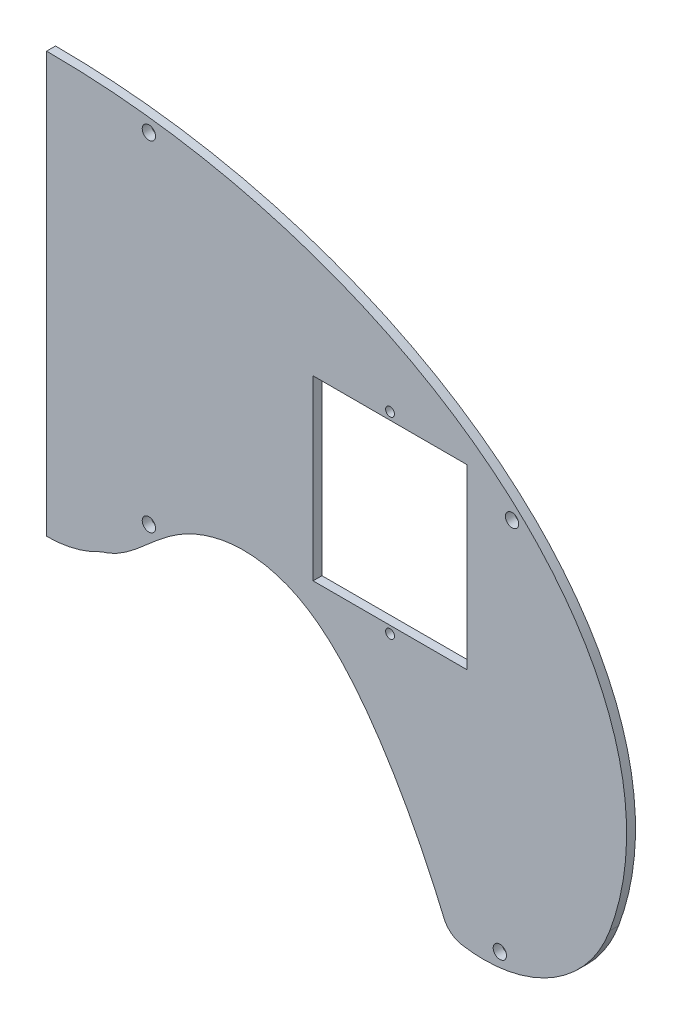
from build123d import *

# Parameters (mm, degrees)
CROQUIS7_R                 = 2.25
CROQUIS7_R_2               = 2
SALIENTE_EXTRUIR5_DEPTH    = 3
CROQUIS8_W                 = 14.2
CROQUIS8_H                 = 14.2
SALIENTE_EXTRUIR6_DEPTH    = 30
CROQUIS9_W                 = 12.2
CROQUIS9_H                 = 12.2
CORTAR_EXTRUIR3_DEPTH      = 3.5
CROQUIS10_R                = 1.5
CROQUIS10_W                = 52
CROQUIS10_H                = 60
CORTAR_EXTRUIR4_DEPTH      = 10
CROQUIS11_R                = 2
CORTAR_EXTRUIR5_DEPTH      = 244.062677057
CORTAR_EXTRUIR6_DEPTH      = 10
CORTAR_EXTRUIR6_DEPTH_BACK = 40


with BuildPart() as part:
    # Croquis7 → Saliente-Extruir5 (new body)
    with BuildSketch(Plane(origin=(0, 0, 0), x_dir=(-1, 0, 0), z_dir=(0, 0, 1))):
        with BuildLine():
            ThreePointArc((140.348102944, 60.535906772), (136.868803986, 59.039740818), (134.467588313, 56.110884882))
            add(Edge.make_bspline(
                [(134.467588313, 56.110884882), (134.149654238, 55.334133411), (133.822967437, 54.561974551), (133.162468089, 53.021395753), (132.827829682, 52.253409151), (131.813137405, 49.95510413), (129.740491118, 45.381193792), (127.554094799, 40.866968809), (124.537000873, 34.901469121), (122.977142227, 31.945642839), (119.740627649, 26.095274542), (118.063871011, 23.200785369), (115.441409795, 18.91536637), (114.549338579, 17.496294783), (112.72383113, 14.679856092), (111.790405163, 13.282650688), (108.93090019, 9.143306555), (106.942158815, 6.448783713), (103.789519774, 2.5408027), (102.709995436, 1.260750849), (101.03852657, -0.618140745), (100.472644941, -1.237551258), (99.321371183, -2.460973153), (98.735216612, -3.065706766), (96.949611744, -4.848397798), (95.725315546, -5.992490783), (93.193460811, -8.17168186), (91.885551874, -9.206321258), (89.163749912, -11.136861166), (87.750446472, -12.033533472), (85.542380661, -13.263200338), (84.789940556, -13.654501875), (83.273337808, -14.386945731), (82.507210908, -14.729300557), (80.185156663, -15.684162987), (78.605545886, -16.224438396), (76.18690973, -16.88473526), (75.372506069, -17.079850593), (73.726807841, -17.418565616), (72.893614615, -17.562445585), (68.705243638, -18.145869815), (65.366316414, -18.172349369), (61.206552273, -17.685687456), (60.375297364, -17.562248247), (58.714202725, -17.262432714), (57.885084071, -17.085992517), (55.432802766, -16.486020136), (53.833347943, -15.990242323), (50.701372835, -14.817551431), (49.168805031, -14.140766948), (46.919374597, -12.991848579), (46.176109393, -12.585433423), (44.71844096, -11.734682347), (44.00330992, -11.290078896), (41.89786804, -9.900210079), (40.548675898, -8.897248108), (37.915404815, -6.799959147), (36.631444442, -5.705240729), (34.080234787, -3.494531224), (32.813017874, -2.37801674), (30.236662295, -0.200762722), (28.927839074, 0.860396497), (26.200660035, 2.836986891), (24.782534521, 3.752724475), (22.513326989, 4.937380803), (21.731218891, 5.30092632), (20.538800155, 5.779648827), (20.137325925, 5.928599802), (19.528876591, 6.135464876), (19.325056364, 6.201754934), (18.915138447, 6.32828856), (18.709169476, 6.388873867), (18.503492991, 6.450235701)],
                knots=[0, 0, 0, 0, 0.015625, 0.015625, 0.03125, 0.03125, 0.0625, 0.125, 0.125, 0.1875, 0.1875, 0.25, 0.25, 0.28125, 0.28125, 0.3125, 0.3125, 0.375, 0.375, 0.40625, 0.40625, 0.421875, 0.421875, 0.4375, 0.4375, 0.46875, 0.46875, 0.5, 0.5, 0.53125, 0.53125, 0.546875, 0.546875, 0.5625, 0.5625, 0.59375, 0.59375, 0.609375, 0.609375, 0.625, 0.625, 0.6875, 0.6875, 0.703125, 0.703125, 0.71875, 0.71875, 0.75, 0.75, 0.78125, 0.78125, 0.796875, 0.796875, 0.8125, 0.8125, 0.84375, 0.84375, 0.875, 0.875, 0.90625, 0.90625, 0.9375, 0.9375, 0.96875, 0.96875, 0.984375, 0.984375, 0.9921875, 0.9921875, 0.99609375, 0.99609375, 1, 1, 1, 1], degree=3))
            ThreePointArc((18.503492991, 6.450235701), (9.568725558, 9.968187997), (0.041286445, 11.165669263))
            ThreePointArc((0.041286445, 11.165669263), (-9.486152668, 9.968187997), (-18.420920101, 6.450235701))
            add(Edge.make_bspline(
                [(-18.420920101, 6.450235701), (-18.623940111, 6.389666404), (-18.827355959, 6.329830822), (-19.231521602, 6.205217931), (-19.432092857, 6.140109685), (-20.029834347, 5.937422038), (-20.422847663, 5.792137477), (-21.586408936, 5.327592923), (-23.851571133, 4.283655696), (-25.957152112, 2.943922804), (-27.995784216, 1.480095188), (-28.664890842, 0.970984568), (-29.983921002, -0.073329511), (-31.932785293, -1.677966714), (-33.830609801, -3.348234863), (-37.648198778, -6.660559044), (-40.223642402, -8.829704647), (-43.732103414, -11.16931662), (-44.447751487, -11.619293464), (-45.90833942, -12.481581481), (-46.654055565, -12.894111913), (-48.910026429, -14.05945093), (-50.447191979, -14.745557377), (-53.587886072, -15.936216829), (-55.191605427, -16.440247818), (-57.65002542, -17.051733947), (-58.478840799, -17.231454942), (-60.152957814, -17.539864916), (-60.990189376, -17.667132679), (-65.177200996, -18.170568112), (-68.529524477, -18.150830669), (-72.723459823, -17.57652989), (-73.56537326, -17.433195972), (-75.227722525, -17.094199895), (-76.049649818, -16.898572429), (-78.48861692, -16.235921786), (-80.078810549, -15.693041625), (-82.413070582, -14.734529063), (-83.182665748, -14.391031128), (-84.704996506, -13.656396586), (-85.459349689, -13.264347284), (-87.686334065, -12.023619951), (-89.109100698, -11.119013238), (-91.845960574, -9.173794538), (-93.159325686, -8.13227129), (-95.699651961, -5.941089833), (-96.92657944, -4.791389468), (-99.311327975, -2.405501713), (-100.470747098, -1.167746926), (-102.705277757, 1.350255866), (-103.784333544, 2.63413345), (-106.931979291, 6.54404893), (-108.909553818, 9.229342103), (-112.69311531, 14.711639925), (-114.498345943, 17.509136981), (-117.975283478, 23.191061246), (-119.646743776, 26.075649006), (-122.879072623, 31.916824892), (-124.439905913, 34.873435974), (-127.463527635, 40.850489896), (-128.925763536, 43.869333899), (-131.039316303, 48.429617131), (-132.076557677, 50.718681564), (-133.080557539, 53.0229294), (-133.740912999, 54.563195318), (-134.0674355, 55.334997841), (-134.385015461, 56.110884961)],
                knots=[0, 0, 0, 0, 0.00390625, 0.00390625, 0.0078125, 0.0078125, 0.015625, 0.015625, 0.03125, 0.0625, 0.0625, 0.078125, 0.078125, 0.09375, 0.125, 0.125, 0.1875, 0.1875, 0.203125, 0.203125, 0.21875, 0.21875, 0.25, 0.25, 0.28125, 0.28125, 0.296875, 0.296875, 0.3125, 0.3125, 0.375, 0.375, 0.390625, 0.390625, 0.40625, 0.40625, 0.4375, 0.4375, 0.453125, 0.453125, 0.46875, 0.46875, 0.5, 0.5, 0.53125, 0.53125, 0.5625, 0.5625, 0.59375, 0.59375, 0.625, 0.625, 0.6875, 0.6875, 0.75, 0.75, 0.8125, 0.8125, 0.875, 0.875, 0.9375, 0.9375, 0.96875, 0.984375, 0.984375, 1, 1, 1, 1], degree=3))
            ThreePointArc((-134.385015461, 56.110884961), (-136.786231132, 59.039740844), (-140.265530055, 60.535906772))
            add(Edge.make_bspline(
                [(-140.265530055, 60.535906772), (-142.869313612, 60.975194236), (-145.472736764, 61.181545126), (-149.377353564, 61.156324129), (-150.678805664, 61.091795359), (-152.630851923, 60.909758714), (-153.281511997, 60.834852812), (-154.582787463, 60.656161872), (-155.234853603, 60.552101706), (-158.476802726, 59.961533397), (-160.993294496, 59.270458626), (-164.656700058, 57.918026872), (-165.859171506, 57.414272212), (-167.634457246, 56.578016163), (-168.221475639, 56.285808038), (-169.38587085, 55.674041203), (-169.964457435, 55.353726594), (-172.807439805, 53.697511994), (-174.937398486, 52.192576754), (-177.922607968, 49.673841605), (-178.882521506, 48.790456721), (-180.268716868, 47.398497719), (-180.721823613, 46.9233488), (-181.609804133, 45.950331764), (-182.044492036, 45.452521121), (-184.149785555, 42.932694997), (-185.636363328, 40.798932433), (-188.228703234, 36.30425224), (-189.334510792, 33.943361708), (-190.239592269, 31.46273884)],
                knots=[0, 0, 0, 0, 0.125, 0.125, 0.1875, 0.1875, 0.21875, 0.21875, 0.25, 0.25, 0.375, 0.375, 0.4375, 0.4375, 0.46875, 0.46875, 0.5, 0.5, 0.625, 0.625, 0.6875, 0.6875, 0.71875, 0.71875, 0.75, 0.75, 0.875, 0.875, 1, 1, 1, 1], degree=3))
            add(Edge.make_bspline(
                [(-190.239592269, 31.46273884), (-192.375255576, 25.696350204), (-193.930960398, 19.817912179), (-195.353011767, 10.824149994), (-195.674576312, 7.796775057), (-195.917624035, 3.209479486), (-195.95859604, 1.668142737), (-195.958829749, -1.399076424), (-195.918430127, -2.92654924), (-195.518471979, -10.533929614), (-194.56743795, -16.524250265), (-192.629288141, -23.898650857), (-192.204015591, -25.3678295), (-191.509820309, -27.563072124), (-191.268868279, -28.293875271), (-190.770797886, -29.745373087), (-190.513422668, -30.466933466), (-189.18582541, -34.054284362), (-187.99353352, -36.858768915), (-185.368434906, -42.346946573), (-183.935518187, -45.030584436), (-181.616583515, -48.97088495), (-180.815309976, -50.270107971), (-179.15756631, -52.840833163), (-178.299496505, -54.114584529), (-173.894487634, -60.387567833), (-170.029043597, -65.071235074), (-161.734486632, -73.885990461), (-157.304059995, -78.015790745), (-151.455251464, -82.873380155), (-150.269861365, -83.829577122), (-147.868570878, -85.712061036), (-146.651110312, -86.639504887), (-142.965561618, -89.369434932), (-140.47059657, -91.115230775), (-132.88142891, -96.148767416), (-127.683244876, -99.23322641), (-117.044436945, -104.928178838), (-111.603518482, -107.538096399), (-100.500242462, -112.325022089), (-94.837739322, -114.501745604), (-87.628813583, -116.966944585), (-86.180135392, -117.447244101), (-83.281186284, -118.37891039), (-78.92614565, -119.734494508), (-74.551754575, -120.967502962), (-65.778285791, -123.277142009), (-59.896441582, -124.608717398), (-48.071099861, -126.88132439), (-42.127581641, -127.822224818), (-30.181011709, -129.326909852), (-18.174890213, -130.454364585), (-6.05076732, -130.834337664), (0.041286395, -130.834337718)],
                knots=[0, 0, 0, 0, 0.0625, 0.0625, 0.09375, 0.09375, 0.109375, 0.109375, 0.125, 0.125, 0.1875, 0.1875, 0.203125, 0.203125, 0.2109375, 0.2109375, 0.21875, 0.21875, 0.25, 0.25, 0.28125, 0.28125, 0.296875, 0.296875, 0.3125, 0.3125, 0.375, 0.375, 0.4375, 0.4375, 0.453125, 0.453125, 0.46875, 0.46875, 0.5, 0.5, 0.5625, 0.5625, 0.625, 0.625, 0.6875, 0.6875, 0.703125, 0.703125, 0.71875, 0.75, 0.75, 0.8125, 0.8125, 0.875, 0.875, 0.9375, 1, 1, 1, 1], degree=3))
            add(Edge.make_bspline(
                [(0.041286395, -130.834337718), (6.134538372, -130.834337861), (18.261394111, -130.454215542), (30.270890379, -129.326191765), (42.221146328, -127.820644803), (48.166664918, -126.879178393), (59.996316501, -124.605051093), (65.880471618, -123.272531195), (74.657643286, -120.961098273), (79.033976886, -119.727301499), (83.391005428, -118.370478603), (86.291297223, -117.437928825), (87.740322905, -116.957264458), (94.94849915, -114.491286465), (100.612718757, -112.313197934), (111.723756279, -107.520808049), (117.170703974, -104.9067671), (127.825648694, -99.19923472), (133.033931688, -96.106317082), (139.373186051, -91.896862023), (140.632464259, -91.037770104), (143.133063373, -89.283555245), (144.374861494, -88.388007586), (148.052238664, -85.660160511), (150.446425915, -83.782144112), (157.447735696, -77.960356266), (161.874926497, -73.830213662), (168.100826372, -67.205265408), (170.107260305, -64.925618709), (173.00207465, -61.387202315), (173.947865617, -60.187897794), (175.799183824, -57.747584062), (176.704009528, -56.507250952), (181.087838152, -50.248918472), (184.175371038, -45.022352222), (188.097143692, -36.810598338), (189.285816024, -34.01118958), (190.610308183, -30.427356556), (190.867135429, -29.70635937), (191.364231806, -28.255685919), (191.604838096, -27.524920821), (192.298313078, -25.328623504), (192.722722681, -23.859837654), (194.655712304, -16.493027919), (195.598905702, -10.526579041), (196.07921656, -1.463811899), (196.083096745, 1.576017168), (195.845385004, 6.165233834), (195.724990331, 7.703216662), (195.405329025, 10.754442145), (195.206051361, 12.271290951), (194.017367953, 19.812812816), (192.45374436, 25.709911997), (190.316013842, 31.479461946)],
                knots=[0, 0, 0, 0, 0.0625, 0.125, 0.125, 0.1875, 0.1875, 0.25, 0.25, 0.28125, 0.296875, 0.296875, 0.3125, 0.3125, 0.375, 0.375, 0.4375, 0.4375, 0.5, 0.5, 0.515625, 0.515625, 0.53125, 0.53125, 0.5625, 0.5625, 0.625, 0.625, 0.65625, 0.65625, 0.671875, 0.671875, 0.6875, 0.6875, 0.75, 0.75, 0.78125, 0.78125, 0.7890625, 0.7890625, 0.796875, 0.796875, 0.8125, 0.8125, 0.875, 0.875, 0.90625, 0.90625, 0.921875, 0.921875, 0.9375, 0.9375, 1, 1, 1, 1], degree=3))
            ThreePointArc((190.316013842, 31.479461946), (170.584652034, 55.040486981), (140.348102944, 60.535906772))
        make_face()
        with Locations(Location((-153.110491216, 56.165669263, 0), (0, 0, 180))):
            Circle(CROQUIS7_R, mode=Mode.SUBTRACT)
        with Locations(Location((-34.515211049, -9.615590181, 0), (0, 0, 180))):
            Circle(CROQUIS7_R, mode=Mode.SUBTRACT)
        with Locations(Location((34.597783939, -9.615590181, 0), (0, 0, 180))):
            Circle(CROQUIS7_R_2, mode=Mode.SUBTRACT)
        with Locations(Location((153.193064106, 56.165669263, 0), (0, 0, 180))):
            Circle(CROQUIS7_R_2, mode=Mode.SUBTRACT)
        with Locations(Location((-157.251517535, -72.229628149, 0), (0, 0, 180))):
            Circle(CROQUIS7_R, mode=Mode.SUBTRACT)
        with Locations(Location((-34.515211049, -124.304498834, 0), (0, 0, 180))):
            Circle(CROQUIS7_R, mode=Mode.SUBTRACT)
        with Locations(Location((34.597783939, -124.304498834, 0), (0, 0, 180))):
            Circle(CROQUIS7_R_2, mode=Mode.SUBTRACT)
        with Locations(Location((157.334090424, -71.312448831, 0), (0, 0, 180))):
            Circle(CROQUIS7_R_2, mode=Mode.SUBTRACT)
    extrude(amount=SALIENTE_EXTRUIR5_DEPTH)

    # Croquis8 → Saliente-Extruir6 (add)
    with BuildSketch(Plane.XY.offset(3)):
        with Locations((0, 20)):
            Rectangle(CROQUIS8_W, CROQUIS8_H)
    extrude(amount=-SALIENTE_EXTRUIR6_DEPTH)

    # Croquis9 → Cortar-Extruir3 (cut)
    with BuildSketch(Plane(origin=(0, 0, -27), x_dir=(-1, 0, 0), z_dir=(0, 0, -1))):
        with Locations((0, 20)):
            Rectangle(CROQUIS9_W, CROQUIS9_H)
    extrude(amount=-CORTAR_EXTRUIR3_DEPTH, mode=Mode.SUBTRACT)

    # Croquis10 → Cortar-Extruir4 (cut)
    with BuildSketch(Plane.XY.offset(3)):
        with Locations((116, 83.334330737)):
            Circle(CROQUIS10_R)
        with Locations((116, 18.334330737)):
            Circle(CROQUIS10_R)
        with Locations((116, 50.834330737)):
            Rectangle(CROQUIS10_W, CROQUIS10_H)
    extrude(amount=-CORTAR_EXTRUIR4_DEPTH, mode=Mode.SUBTRACT)

    # Croquis11 → Cortar-Extruir5 (cut, through all)
    with BuildSketch(Plane.ZY.offset(7.1)):
        with Locations(Location((-7, 20, 0), (0, 0, 270))):
            Circle(CROQUIS11_R)
    extrude(amount=-CORTAR_EXTRUIR5_DEPTH, mode=Mode.SUBTRACT)

    # Croquis12 → Cortar-Extruir6 (cut, two sides: drawn at the far end of the back side and taken through both)
    with BuildSketch(Plane.XY.offset(3).offset(-CORTAR_EXTRUIR6_DEPTH_BACK)):
        with BuildLine():
            Line((-0.041286395, -11.165669263), (-0.041286395, 130.834337718))
            add(Edge.make_bspline(
                [(-0.041286395, 130.834337718), (-6.134538372, 130.834337861), (-18.261394111, 130.454215542), (-30.270890379, 129.326191765), (-42.221146328, 127.820644803), (-48.166664918, 126.879178393), (-59.996316501, 124.605051093), (-65.880471618, 123.272531195), (-74.657643286, 120.961098273), (-79.033976886, 119.727301499), (-83.391005428, 118.370478603), (-86.291297223, 117.437928825), (-87.740322905, 116.957264458), (-94.94849915, 114.491286465), (-100.612718757, 112.313197934), (-111.723756279, 107.520808049), (-117.170703974, 104.9067671), (-127.825648694, 99.19923472), (-133.033931688, 96.106317082), (-139.373186051, 91.896862023), (-140.632464259, 91.037770104), (-143.133063373, 89.283555245), (-144.374861494, 88.388007586), (-148.052238664, 85.660160511), (-150.446425915, 83.782144112), (-157.447735696, 77.960356266), (-161.874926497, 73.830213662), (-168.100826372, 67.205265408), (-170.107260305, 64.925618709), (-173.00207465, 61.387202315), (-173.947865617, 60.187897794), (-175.799183824, 57.747584062), (-176.704009528, 56.507250952), (-181.087838152, 50.248918472), (-184.175371038, 45.022352222), (-188.097143692, 36.810598338), (-189.285816024, 34.01118958), (-190.610308183, 30.427356556), (-190.867135429, 29.70635937), (-191.364231806, 28.255685919), (-191.604838096, 27.524920821), (-192.298313078, 25.328623504), (-192.722722681, 23.859837654), (-194.655712304, 16.493027919), (-195.598905702, 10.526579041), (-196.07921656, 1.463811899), (-196.083096745, -1.576017168), (-195.845385004, -6.165233834), (-195.724990331, -7.703216662), (-195.405329025, -10.754442145), (-195.206051361, -12.271290951), (-194.017367953, -19.812812816), (-192.45374436, -25.709911997), (-190.316013842, -31.479461946)],
                knots=[0, 0, 0, 0, 0.0625, 0.125, 0.125, 0.1875, 0.1875, 0.25, 0.25, 0.28125, 0.296875, 0.296875, 0.3125, 0.3125, 0.375, 0.375, 0.4375, 0.4375, 0.5, 0.5, 0.515625, 0.515625, 0.53125, 0.53125, 0.5625, 0.5625, 0.625, 0.625, 0.65625, 0.65625, 0.671875, 0.671875, 0.6875, 0.6875, 0.75, 0.75, 0.78125, 0.78125, 0.7890625, 0.7890625, 0.796875, 0.796875, 0.8125, 0.8125, 0.875, 0.875, 0.90625, 0.90625, 0.921875, 0.921875, 0.9375, 0.9375, 1, 1, 1, 1], degree=3))
            ThreePointArc((-190.316013842, -31.479461946), (-170.584652034, -55.040486981), (-140.348102944, -60.535906772))
            ThreePointArc((-140.348102944, -60.535906772), (-136.868803986, -59.039740818), (-134.467588313, -56.110884882))
            add(Edge.make_bspline(
                [(-134.467588313, -56.110884882), (-134.149654238, -55.334133411), (-133.822967437, -54.561974551), (-133.162468089, -53.021395753), (-132.827829682, -52.253409151), (-131.813137405, -49.95510413), (-129.740491118, -45.381193792), (-127.554094799, -40.866968809), (-124.537000873, -34.901469121), (-122.977142227, -31.945642839), (-119.740627649, -26.095274542), (-118.063871011, -23.200785369), (-115.441409795, -18.91536637), (-114.549338579, -17.496294783), (-112.72383113, -14.679856092), (-111.790405163, -13.282650688), (-108.93090019, -9.143306555), (-106.942158815, -6.448783713), (-103.789519774, -2.5408027), (-102.709995436, -1.260750849), (-101.03852657, 0.618140745), (-100.472644941, 1.237551258), (-99.321371183, 2.460973153), (-98.735216612, 3.065706766), (-96.949611744, 4.848397798), (-95.725315546, 5.992490783), (-93.193460811, 8.17168186), (-91.885551874, 9.206321258), (-89.163749912, 11.136861166), (-87.750446472, 12.033533472), (-85.542380661, 13.263200338), (-84.789940556, 13.654501875), (-83.273337808, 14.386945731), (-82.507210908, 14.729300557), (-80.185156663, 15.684162987), (-78.605545886, 16.224438396), (-76.18690973, 16.88473526), (-75.372506069, 17.079850593), (-73.726807841, 17.418565616), (-72.893614615, 17.562445585), (-68.705243638, 18.145869815), (-65.366316414, 18.172349369), (-61.206552273, 17.685687456), (-60.375297364, 17.562248247), (-58.714202725, 17.262432714), (-57.885084071, 17.085992517), (-55.432802766, 16.486020136), (-53.833347943, 15.990242323), (-50.701372835, 14.817551431), (-49.168805031, 14.140766948), (-46.919374597, 12.991848579), (-46.176109393, 12.585433423), (-44.71844096, 11.734682347), (-44.00330992, 11.290078896), (-41.89786804, 9.900210079), (-40.548675898, 8.897248108), (-37.915404815, 6.799959147), (-36.631444442, 5.705240729), (-34.080234787, 3.494531224), (-32.813017874, 2.37801674), (-30.236662295, 0.200762722), (-28.927839074, -0.860396497), (-26.200660035, -2.836986891), (-24.782534521, -3.752724475), (-22.513326989, -4.937380803), (-21.731218891, -5.30092632), (-20.538800155, -5.779648827), (-20.137325925, -5.928599802), (-19.528876591, -6.135464876), (-19.325056364, -6.201754934), (-18.915138447, -6.32828856), (-18.709169476, -6.388873867), (-18.503492991, -6.450235701)],
                knots=[0, 0, 0, 0, 0.015625, 0.015625, 0.03125, 0.03125, 0.0625, 0.125, 0.125, 0.1875, 0.1875, 0.25, 0.25, 0.28125, 0.28125, 0.3125, 0.3125, 0.375, 0.375, 0.40625, 0.40625, 0.421875, 0.421875, 0.4375, 0.4375, 0.46875, 0.46875, 0.5, 0.5, 0.53125, 0.53125, 0.546875, 0.546875, 0.5625, 0.5625, 0.59375, 0.59375, 0.609375, 0.609375, 0.625, 0.625, 0.6875, 0.6875, 0.703125, 0.703125, 0.71875, 0.71875, 0.75, 0.75, 0.78125, 0.78125, 0.796875, 0.796875, 0.8125, 0.8125, 0.84375, 0.84375, 0.875, 0.875, 0.90625, 0.90625, 0.9375, 0.9375, 0.96875, 0.96875, 0.984375, 0.984375, 0.9921875, 0.9921875, 0.99609375, 0.99609375, 1, 1, 1, 1], degree=3))
            ThreePointArc((-18.503492991, -6.450235701), (-9.568725534, -9.968188003), (-0.041286395, -11.165669263))
        make_face()
    extrude(amount=CORTAR_EXTRUIR6_DEPTH + CORTAR_EXTRUIR6_DEPTH_BACK, mode=Mode.SUBTRACT)


solid = part.part
